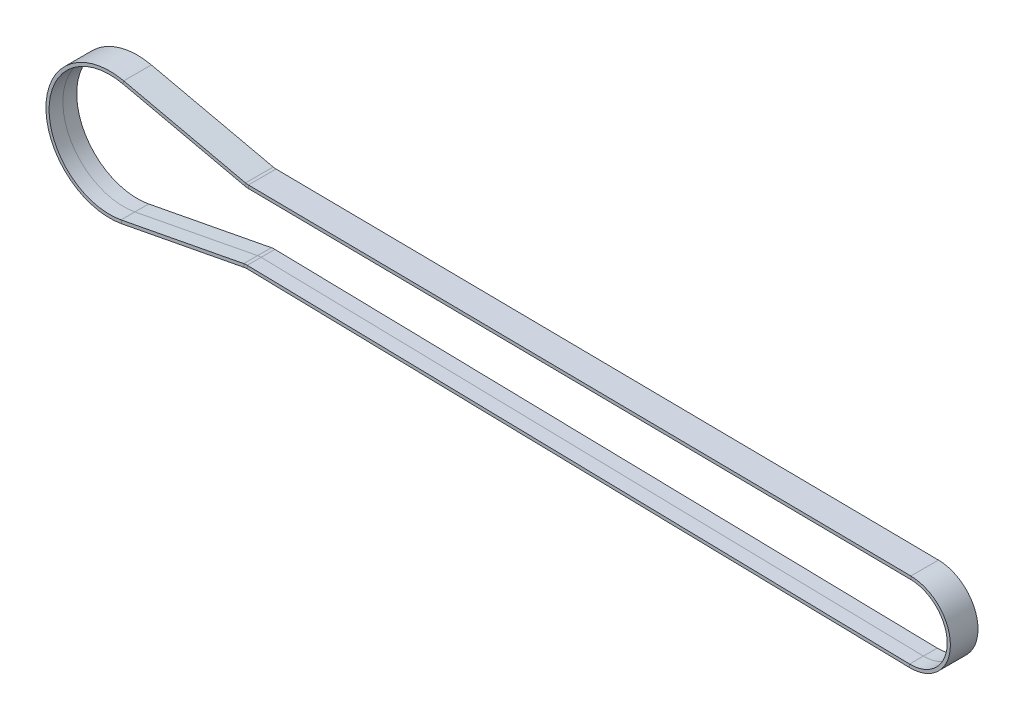
from build123d import *


with BuildPart() as part:
    # Sweep1: sweep along a path in Sketch2
    with BuildLine(Plane.XY) as sweep1_path:
        Line((-0.068134692, -6.069617588), (239.821114694, -8.762502254))
        ThreePointArc((239.821114694, -8.762502254), (253.019487784, -22.329381995), (239.385678731, -35.458606224))
        Line((239.385678731, -35.458606224), (-0.463785683, -30.326548014))
        ThreePointArc((-0.463785683, -30.326548014), (-1.102309453, -30.346510276), (-1.735198918, -30.43347016))
        Line((-1.735198918, -30.43347016), (-46.162110126, -38.940476793))
        ThreePointArc((-46.162110126, -38.940476793), (-72.237248856, -17.024170339), (-45.461223928, 4.030089027))
        Line((-45.461223928, 4.030089027), (-1.335384562, -5.921287704))
        ThreePointArc((-1.335384562, -5.921287704), (-0.705667778, -6.028841762), (-0.068134692, -6.069617588))
    # Sketch5 → Sweep1 (sweep)
    with BuildSketch(Plane(origin=(-45.461223928, 4.030089027, 0), x_dir=(0, 0, 1), z_dir=(-0.9755004454434599, 0.21999745666623377, 0))):
        Polygon((0, 0), (5, 0), (5, 1.14), (-5, 1.14), (-5, 0), align=None)
    sweep(path=sweep1_path.line)


solid = part.part
